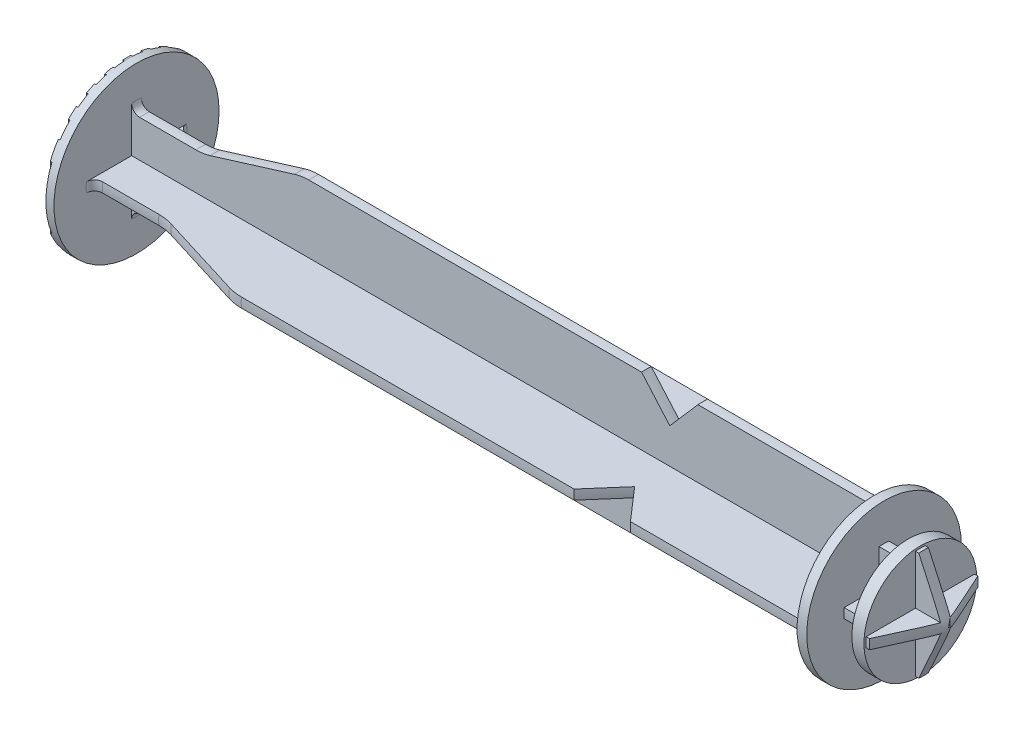
from build123d import *

# Parameters (mm, degrees)
SKETCH2_OUTSIDE_W   = 43.708
SKETCH2_OUTSIDE_H   = 43.708
CUT_EXTRUDE1_DEPTH  = 91.6
SKETCH3_OUTSIDE_W   = 43.708
SKETCH3_OUTSIDE_H   = 43.708
SKETCH3_OUTSIDE_W_2 = 1
SKETCH3_OUTSIDE_H_2 = 20.47559523
CUT_EXTRUDE2_DEPTH  = 0.2
SKETCH4_OUTSIDE_W   = 43.708
SKETCH4_OUTSIDE_H   = 43.708
CUT_EXTRUDE3_DEPTH  = 3
SKETCH5_OUTSIDE_W   = 43.708
SKETCH5_OUTSIDE_H   = 43.708
CUT_EXTRUDE4_DEPTH  = 3.5


with BuildPart() as part:
    # Sketch1 → Revolve1 (revolve)
    with BuildSketch(Plane.XY, mode=Mode.PRIVATE) as revolve1_sk:
        with BuildLine():
            Line((0, 0), (0, 10.25))
            Line((0, 10.25), (1.2, 10.25))
            Line((1.2, 10.25), (1.2, 6.25))
            ThreePointArc((1.2, 6.25), (1.492893219, 5.542893219), (2.2, 5.25))
            Line((2.2, 5.25), (9.2, 5.25))
            ThreePointArc((9.2, 5.25), (10.091531796, 5.316605436), (10.963269971, 5.514942981))
            Line((10.963269971, 5.514942981), (21.436730029, 8.735057019))
            ThreePointArc((21.436730029, 8.735057019), (22.308468204, 8.933394564), (23.2, 9))
            Line((23.2, 9), (64.5, 9))
            Line((64.5, 9), (68, 5))
            Line((68, 5), (71.5, 9))
            Line((71.5, 9), (92.8, 9))
            Line((92.8, 9), (92.8, 9.6))
            Line((92.8, 9.6), (94, 9.6))
            Line((94, 9.6), (94, 5))
            Line((94, 5), (97, 5))
            Line((97, 5), (97, 7))
            Line((97, 7), (98.8, 7))
            Line((98.8, 7), (102, 0))
            Line((102, 0), (0, 0))
        make_face()
    revolve(revolve1_sk.sketch.rotate(Axis((102, 0, 0), (-1, 0, 0)), 90), axis=Axis((102, 0, 0), (-1, 0, 0)))

    # Sketch2 outside → Cut-Extrude1 (cut)
    with BuildSketch(Plane(origin=(1.2, 0, 0), x_dir=(0, 0, -1), z_dir=(1, 0, 0))):
        Rectangle(SKETCH2_OUTSIDE_W, SKETCH2_OUTSIDE_H)
        with BuildLine():
            Line((-0.6, 10.232423955), (-0.6, 0.6))
            Line((-0.6, 0.6), (-10.232423955, 0.6))
            ThreePointArc((-10.232423955, 0.6), (-10.25, 0), (-10.232423955, -0.6))
            Line((-10.232423955, -0.6), (-0.6, -0.6))
            Line((-0.6, -0.6), (-0.6, -10.232423955))
            ThreePointArc((-0.6, -10.232423955), (0, -10.25), (0.6, -10.232423955))
            Line((0.6, -10.232423955), (0.6, -0.6))
            Line((0.6, -0.6), (10.232423955, -0.6))
            ThreePointArc((10.232423955, -0.6), (10.25, 0), (10.232423955, 0.6))
            Line((10.232423955, 0.6), (0.6, 0.6))
            Line((0.6, 0.6), (0.6, 10.232423955))
            ThreePointArc((0.6, 10.232423955), (0, 10.25), (-0.6, 10.232423955))
        make_face(mode=Mode.SUBTRACT)
    extrude(amount=CUT_EXTRUDE1_DEPTH, mode=Mode.SUBTRACT)

    # Sketch3 outside → Cut-Extrude2 (cut)
    with BuildSketch(Plane.ZY):
        Rectangle(SKETCH3_OUTSIDE_W, SKETCH3_OUTSIDE_H)
        with Locations((2.25, 0)):
            Rectangle(SKETCH3_OUTSIDE_W_2, SKETCH3_OUTSIDE_H_2, mode=Mode.SUBTRACT)
        Rectangle(SKETCH3_OUTSIDE_W_2, SKETCH3_OUTSIDE_H_2, mode=Mode.SUBTRACT)
        with Locations((4.5, 0)):
            Rectangle(SKETCH3_OUTSIDE_W_2, SKETCH3_OUTSIDE_H_2, mode=Mode.SUBTRACT)
        with Locations((6.75, 0)):
            Rectangle(SKETCH3_OUTSIDE_W_2, SKETCH3_OUTSIDE_H_2, mode=Mode.SUBTRACT)
        with Locations((9, 0)):
            Rectangle(SKETCH3_OUTSIDE_W_2, SKETCH3_OUTSIDE_H_2, mode=Mode.SUBTRACT)
        with Locations((11.25, 0)):
            Rectangle(SKETCH3_OUTSIDE_W_2, SKETCH3_OUTSIDE_H_2, mode=Mode.SUBTRACT)
        with Locations((13.5, 0)):
            Rectangle(SKETCH3_OUTSIDE_W_2, SKETCH3_OUTSIDE_H_2, mode=Mode.SUBTRACT)
        with Locations((-2.25, 0)):
            Rectangle(SKETCH3_OUTSIDE_W_2, SKETCH3_OUTSIDE_H_2, mode=Mode.SUBTRACT)
        with Locations((-4.5, 0)):
            Rectangle(SKETCH3_OUTSIDE_W_2, SKETCH3_OUTSIDE_H_2, mode=Mode.SUBTRACT)
        with Locations((-6.75, 0)):
            Rectangle(SKETCH3_OUTSIDE_W_2, SKETCH3_OUTSIDE_H_2, mode=Mode.SUBTRACT)
        with Locations((-9, 0)):
            Rectangle(SKETCH3_OUTSIDE_W_2, SKETCH3_OUTSIDE_H_2, mode=Mode.SUBTRACT)
        with Locations((-11.25, 0)):
            Rectangle(SKETCH3_OUTSIDE_W_2, SKETCH3_OUTSIDE_H_2, mode=Mode.SUBTRACT)
        with Locations((-13.5, 0)):
            Rectangle(SKETCH3_OUTSIDE_W_2, SKETCH3_OUTSIDE_H_2, mode=Mode.SUBTRACT)
    extrude(amount=-CUT_EXTRUDE2_DEPTH, mode=Mode.SUBTRACT)

    # Sketch4 outside → Cut-Extrude3 (cut)
    with BuildSketch(Plane(origin=(94, 0, 0), x_dir=(0, 0, -1), z_dir=(1, 0, 0))):
        Rectangle(SKETCH4_OUTSIDE_W, SKETCH4_OUTSIDE_H)
        with BuildLine():
            Line((0.6, 0.6), (0.6, 10.232423955))
            ThreePointArc((0.6, 10.232423955), (0, 10.25), (-0.6, 10.232423955))
            Line((-0.6, 10.232423955), (-0.6, 0.6))
            Line((-0.6, 0.6), (-10.232423955, 0.6))
            ThreePointArc((-10.232423955, 0.6), (-10.25, 0), (-10.232423955, -0.6))
            Line((-10.232423955, -0.6), (-0.6, -0.6))
            Line((-0.6, -0.6), (-0.6, -10.232423955))
            ThreePointArc((-0.6, -10.232423955), (0, -10.25), (0.6, -10.232423955))
            Line((0.6, -10.232423955), (0.6, -0.6))
            Line((0.6, -0.6), (10.232423955, -0.6))
            ThreePointArc((10.232423955, -0.6), (10.25, 0), (10.232423955, 0.6))
            Line((10.232423955, 0.6), (0.6, 0.6))
        make_face(mode=Mode.SUBTRACT)
    extrude(amount=CUT_EXTRUDE3_DEPTH, mode=Mode.SUBTRACT)

    # Sketch5 outside → Cut-Extrude4 (cut)
    with BuildSketch(Plane(origin=(102, 0, 0), x_dir=(0, 0, -1), z_dir=(1, 0, 0))):
        Rectangle(SKETCH5_OUTSIDE_W, SKETCH5_OUTSIDE_H)
        with BuildLine():
            Line((0.6, 0.6), (0.6, 6.723280449))
            ThreePointArc((0.6, 6.723280449), (0, 6.75), (-0.6, 6.723280449))
            Line((-0.6, 6.723280449), (-0.6, 0.6))
            Line((-0.6, 0.6), (-6.723280449, 0.6))
            ThreePointArc((-6.723280449, 0.6), (-6.75, 0), (-6.723280449, -0.6))
            Line((-6.723280449, -0.6), (-0.6, -0.6))
            Line((-0.6, -0.6), (-0.6, -6.723280449))
            ThreePointArc((-0.6, -6.723280449), (0, -6.75), (0.6, -6.723280449))
            Line((0.6, -6.723280449), (0.6, -0.6))
            Line((0.6, -0.6), (6.723280449, -0.6))
            ThreePointArc((6.723280449, -0.6), (6.75, 0), (6.723280449, 0.6))
            Line((6.723280449, 0.6), (0.6, 0.6))
        make_face(mode=Mode.SUBTRACT)
    extrude(amount=-CUT_EXTRUDE4_DEPTH, mode=Mode.SUBTRACT)


solid = part.part
